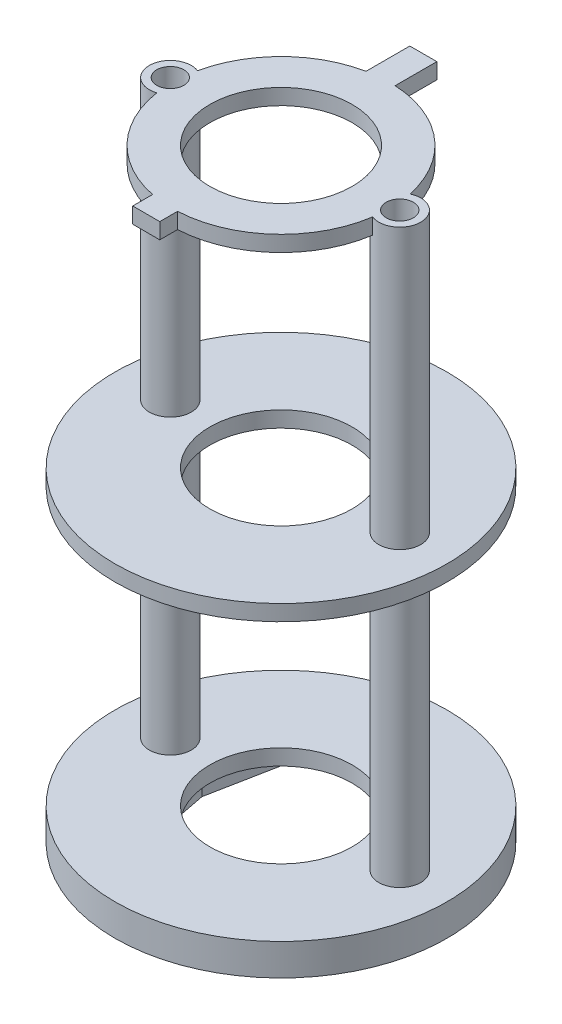
from build123d import *

# Parameters (mm, degrees)
BOSS_EXTRUDE1_DEPTH      = 2
CUT_EXTRUDE1_REACH       = 27.75
SKETCH2_R                = 1.7145
SKETCH3_R                = 1.7145
BOSS_EXTRUDE2_DEPTH      = 72.305
CUT_EXTRUDE2_REACH       = 78.727
SKETCH4_R                = 8.99
BOSS_EXTRUDE3_DEPTH      = 2
BOSS_EXTRUDE3_DEPTH_BACK = 2
SKETCH5_R                = 21
SKETCH5_R_2              = 8.99
CUT_EXTRUDE3_DEPTH       = 2
SKETCH7_R                = 21
SKETCH7_R_2              = 8.99
BOSS_EXTRUDE4_DEPTH      = 2
SKETCH8_R                = 1.7145
BOSS_EXTRUDE5_DEPTH      = 57.305


with BuildPart() as part:
    # Sketch1 → Boss-Extrude1 (new body)
    with BuildSketch(Plane(origin=(0, 0, 0), x_dir=(1, 0, 0), z_dir=(0, 1, 0))):
        with BuildLine():
            Line((-2.743211684, 13.490721697), (-2.743211684, 19.02714))
            Line((-2.743211684, 19.02714), (0.674160958, 19.02714))
            Line((0.674160958, 19.02714), (0.674160958, 13.750283242))
            ThreePointArc((0.674160958, 13.750283242), (8.929745908, 10.47780608), (13.469544487, 2.845374062))
            ThreePointArc((13.469544487, 2.845374062), (17.232722938, 0.513379028), (13.615039655, -2.03849882))
            ThreePointArc((13.615039655, -2.03849882), (9.237791247, -10.207252084), (0.674160958, -13.750283242))
            Line((0.674160958, -13.750283242), (0.674160958, -15.99946))
            Line((0.674160958, -15.99946), (-2.743211684, -15.99946))
            Line((-2.743211684, -15.99946), (-2.743211684, -13.490721697))
            ThreePointArc((-2.743211684, -13.490721697), (-9.966316815, -9.49722651), (-13.607209812, -2.090125207))
            ThreePointArc((-13.607209812, -2.090125207), (-17.080297956, 0.514213195), (-13.456831252, 2.904905316))
            ThreePointArc((-13.456831252, 2.904905316), (-9.676012861, 9.792831937), (-2.743211684, 13.490721697))
        make_face()
    extrude(amount=-BOSS_EXTRUDE1_DEPTH)

    # Sketch2 → Cut-Extrude1 (cut, up to next)
    with BuildSketch(Plane(origin=(0, 0, 0), x_dir=(1, 0, 0), z_dir=(0, 1, 0)), mode=Mode.PRIVATE) as cut_extrude1_sk1:
        with Locations(Location((14.5796, 0.43434, 0), (0, 0, 270))):
            Circle(SKETCH2_R)
    cut_extrude1_tool1 = extrude(cut_extrude1_sk1.sketch, amount=-CUT_EXTRUDE1_REACH, mode=Mode.PRIVATE) & part.part
    # Sketch2 → Cut-Extrude1 (cut, up to next)
    with BuildSketch(Plane(origin=(0, 0, 0), x_dir=(1, 0, 0), z_dir=(0, 1, 0)), mode=Mode.PRIVATE) as cut_extrude1_sk2:
        with Locations(Location((-14.4272, 0.43434, 0), (0, 0, 270))):
            Circle(SKETCH2_R)
    cut_extrude1_tool2 = extrude(cut_extrude1_sk2.sketch, amount=-CUT_EXTRUDE1_REACH, mode=Mode.PRIVATE) & part.part
    add(cut_extrude1_tool1.solids().sort_by_distance((14.5796, 0, -0.43434))[0], mode=Mode.SUBTRACT)
    add(cut_extrude1_tool2.solids().sort_by_distance((-14.4272, 0, -0.43434))[0], mode=Mode.SUBTRACT)

    # Sketch3 → Boss-Extrude2 (add)
    # profile 1 of 2: a face of its own
    with BuildSketch(Plane.XZ.offset(2)):
        with BuildLine():
            ThreePointArc((13.469544487, -2.845374062), (16.011187954, -2.669483042), (17.2339, -0.43434))
            ThreePointArc((17.2339, -0.43434), (16.077110595, 1.757182418), (13.615039655, 2.03849882))
            ThreePointArc((13.615039655, 2.03849882), (11.926477062, -0.355300972), (13.469544487, -2.845374062))
        make_face()
        with Locations(Location((14.5796, -0.43434, 0), (0, 0, 90))):
            Circle(SKETCH3_R, mode=Mode.SUBTRACT)
    # profile 2 of 2: a face of its own
    with BuildSketch(Plane.XZ.offset(2)):
        with BuildLine():
            ThreePointArc((-13.456831252, -2.904905316), (-12.233919551, -1.929274567), (-11.7729, -0.43434))
            ThreePointArc((-11.7729, -0.43434), (-12.279898386, 1.125917756), (-13.607209812, 2.090125207))
            ThreePointArc((-13.607209812, 2.090125207), (-17.080297956, -0.514213195), (-13.456831252, -2.904905316))
        make_face()
        with Locations(Location((-14.4272, -0.43434, 0), (0, 0, 90))):
            Circle(SKETCH3_R, mode=Mode.SUBTRACT)
    extrude(amount=BOSS_EXTRUDE2_DEPTH)

    # Sketch4 → Cut-Extrude2 (cut, up to next)
    with BuildSketch(Plane.XZ.offset(2), mode=Mode.PRIVATE) as cut_extrude2_sk1:
        with Locations(Location((0, 0, 0), (0, 0, 270))):
            Circle(SKETCH4_R)
    cut_extrude2_tool1 = extrude(cut_extrude2_sk1.sketch, amount=-CUT_EXTRUDE2_REACH, mode=Mode.PRIVATE) & part.part
    add(cut_extrude2_tool1.solids().sort_by_distance((0, -2, 0))[0], mode=Mode.SUBTRACT)

    # Sketch5 → Boss-Extrude3 (add, two sides: drawn at the far end of the back side and taken through both)
    with BuildSketch(Plane.XZ.offset(74.305).offset(-BOSS_EXTRUDE3_DEPTH_BACK)):
        with Locations(Location((0, 0, 0), (0, 0, 270))):
            Circle(SKETCH5_R)
        with Locations(Location((0, 0, 0), (0, 0, 270))):
            Circle(SKETCH5_R_2, mode=Mode.SUBTRACT)
    extrude(amount=BOSS_EXTRUDE3_DEPTH + BOSS_EXTRUDE3_DEPTH_BACK)

    # Sketch6 → Cut-Extrude3 (cut)
    with BuildSketch(Plane.XZ.offset(76.305)):
        with BuildLine():
            Line((-7.35, 13.65), (-10, 0))
            Line((-10, 0), (-7.35, -13.65))
            ThreePointArc((-7.35, -13.65), (0, -15.503480297), (7.35, -13.65))
            Line((7.35, -13.65), (10, 0))
            Line((10, 0), (7.35, 13.65))
            ThreePointArc((7.35, 13.65), (0, 15.503480297), (-7.35, 13.65))
        make_face()
    extrude(amount=-CUT_EXTRUDE3_DEPTH, mode=Mode.SUBTRACT)

    # Sketch7 → Boss-Extrude4 (add)
    with BuildSketch(Plane(origin=(0, -37.305, 0), x_dir=(1, 0, 0), z_dir=(0, 1, 0))):
        with Locations(Location((0, 0, 0), (0, 0, 90))):
            Circle(SKETCH7_R)
        with Locations(Location((0, 0, 0), (0, 0, 90))):
            Circle(SKETCH7_R_2, mode=Mode.SUBTRACT)
    extrude(amount=BOSS_EXTRUDE4_DEPTH)

    # Sketch8 → Boss-Extrude5 (add)
    with BuildSketch(Plane(origin=(0, -72.305, 0), x_dir=(1, 0, 0), z_dir=(0, 1, 0))):
        with Locations(Location((-14.4272, 0.43434, 0), (0, 0, 270))):
            Circle(SKETCH8_R)
        with Locations(Location((14.5796, 0.43434, 0), (0, 0, 270))):
            Circle(SKETCH8_R)
    extrude(amount=BOSS_EXTRUDE5_DEPTH)


solid = part.part
